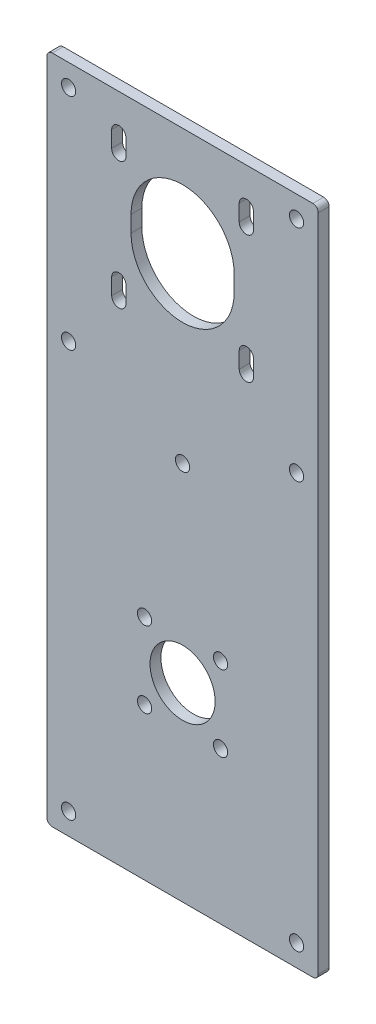
from build123d import *

# Parameters (mm, degrees)
MODEL_R         = 12
MODEL_R_2       = 2.625
EXTRUDE_1_DEPTH = 4


with BuildPart() as part:
    # Model → 凸台-拉伸1 (new body)
    with BuildSketch(Plane.XY):
        with BuildLine():
            Line((239.034732394, 334.032549296), (143.034732394, 334.032549296))
            ThreePointArc((143.034732394, 334.032549296), (141.620518832, 333.446762858), (141.034732394, 332.032549296))
            Line((141.034732394, 332.032549296), (141.034732394, 89.032549296))
            ThreePointArc((141.034732394, 89.032549296), (141.620518832, 87.618335733), (143.034732394, 87.032549296))
            Line((143.034732394, 87.032549296), (239.034732394, 87.032549296))
            ThreePointArc((239.034732394, 87.032549296), (240.448945957, 87.618335733), (241.034732394, 89.032549296))
            Line((241.034732394, 89.032549296), (241.034732394, 332.032549296))
            ThreePointArc((241.034732394, 332.032549296), (240.448945957, 333.446762858), (239.034732394, 334.032549296))
        make_face()
        with Locations((191.034732394, 157.032549296)):
            Circle(MODEL_R, mode=Mode.SUBTRACT)
        with Locations((177.034732394, 171.032549296)):
            Circle(MODEL_R_2, mode=Mode.SUBTRACT)
        with Locations((205.034732394, 171.032549296)):
            Circle(MODEL_R_2, mode=Mode.SUBTRACT)
        with Locations((177.034732394, 143.032549296)):
            Circle(MODEL_R_2, mode=Mode.SUBTRACT)
        with Locations((205.034732394, 143.032549296)):
            Circle(MODEL_R_2, mode=Mode.SUBTRACT)
        with Locations((149.034732394, 95.032549296)):
            Circle(MODEL_R_2, mode=Mode.SUBTRACT)
        with Locations((233.034732394, 95.032549296)):
            Circle(MODEL_R_2, mode=Mode.SUBTRACT)
        with Locations((149.034732394, 245.032549296)):
            Circle(MODEL_R_2, mode=Mode.SUBTRACT)
        with Locations((233.034732394, 245.032549296)):
            Circle(MODEL_R_2, mode=Mode.SUBTRACT)
        with Locations((149.034732394, 326.032549296)):
            Circle(MODEL_R_2, mode=Mode.SUBTRACT)
        with Locations((233.034732394, 326.032549296)):
            Circle(MODEL_R_2, mode=Mode.SUBTRACT)
        with Locations((191.034732394, 227.032549296)):
            Circle(MODEL_R_2, mode=Mode.SUBTRACT)
        with BuildLine():
            Line((217.159732394, 314.532549296), (217.159732394, 320.532549296))
            ThreePointArc((217.159732394, 320.532549296), (214.534732394, 323.157549296), (211.909732394, 320.532549296))
            Line((211.909732394, 320.532549296), (211.909732394, 314.532549296))
            ThreePointArc((211.909732394, 314.532549296), (214.534732394, 311.907549296), (217.159732394, 314.532549296))
        make_face(mode=Mode.SUBTRACT)
        with BuildLine():
            Line((217.159732394, 267.532549296), (217.159732394, 273.532549296))
            ThreePointArc((217.159732394, 273.532549296), (214.534732394, 276.157549296), (211.909732394, 273.532549296))
            Line((211.909732394, 273.532549296), (211.909732394, 267.532549296))
            ThreePointArc((211.909732394, 267.532549296), (214.534732394, 264.907549296), (217.159732394, 267.532549296))
        make_face(mode=Mode.SUBTRACT)
        with BuildLine():
            Line((172.034732394, 297.032549296), (172.034732394, 291.032549296))
            ThreePointArc((172.034732394, 291.032549296), (191.034732394, 272.032549296), (210.034732394, 291.032549296))
            Line((210.034732394, 291.032549296), (210.034732394, 297.032549296))
            ThreePointArc((210.034732394, 297.032549296), (191.034732394, 316.032549296), (172.034732394, 297.032549296))
        make_face(mode=Mode.SUBTRACT)
        with BuildLine():
            Line((170.159732394, 267.532549296), (170.159732394, 273.532549296))
            ThreePointArc((170.159732394, 273.532549296), (167.534732394, 276.157549296), (164.909732394, 273.532549296))
            Line((164.909732394, 273.532549296), (164.909732394, 267.532549296))
            ThreePointArc((164.909732394, 267.532549296), (167.534732394, 264.907549296), (170.159732394, 267.532549296))
        make_face(mode=Mode.SUBTRACT)
        with BuildLine():
            Line((170.159732394, 314.532549296), (170.159732394, 320.532549296))
            ThreePointArc((170.159732394, 320.532549296), (167.534732394, 323.157549296), (164.909732394, 320.532549296))
            Line((164.909732394, 320.532549296), (164.909732394, 314.532549296))
            ThreePointArc((164.909732394, 314.532549296), (167.534732394, 311.907549296), (170.159732394, 314.532549296))
        make_face(mode=Mode.SUBTRACT)
    extrude(amount=EXTRUDE_1_DEPTH)


solid = part.part
